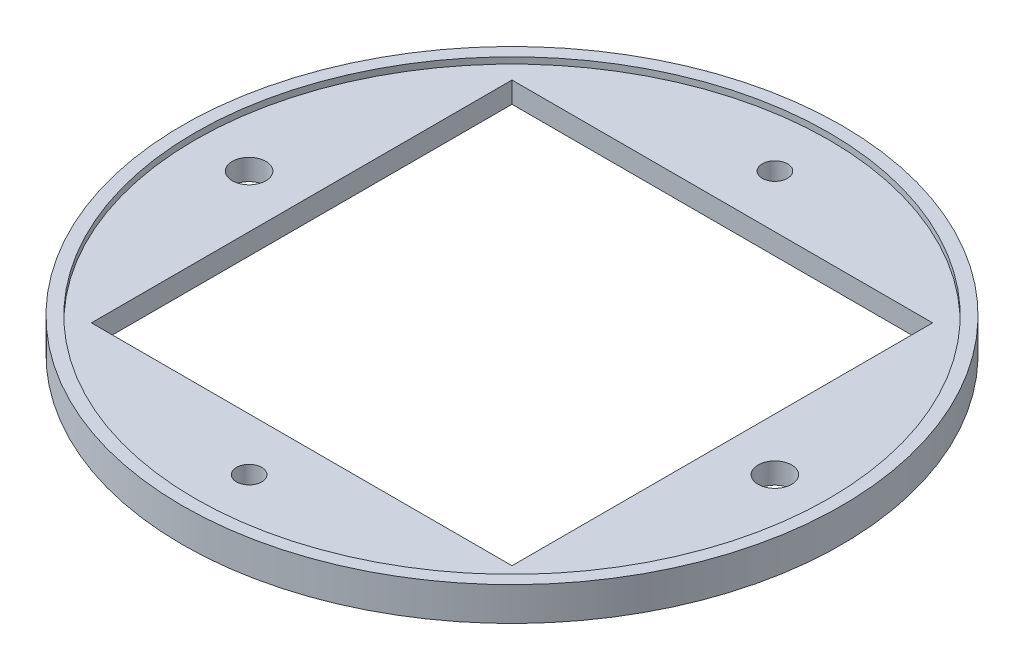
from build123d import *

# Parameters (mm, degrees)
BOSS_EXTRUDE1_DEPTH      = 2.5
BOSS_EXTRUDE1_DEPTH_BACK = 2.5
SKETCH1_R                = 78.35
SKETCH1_R_2              = 4
SKETCH1_R_3              = 3
SKETCH1_W                = 100
SKETCH1_H                = 100
BOSS_EXTRUDE2_DEPTH      = 4
BOSS_EXTRUDE2_DEPTH_BACK = 4
SKETCH2_R                = 78.35
SKETCH2_R_2              = 75.35


with BuildPart() as part:
    # Sketch1 → Boss-Extrude1 (new, two sides: drawn at the far end of the back side and taken through both)
    with BuildSketch(Plane(origin=(0, 0, 0), x_dir=(1, 0, 0), z_dir=(0, 1, 0)).offset(-BOSS_EXTRUDE1_DEPTH_BACK)):
        Circle(SKETCH1_R)
        with Locations((62.5, 0)):
            Circle(SKETCH1_R_2, mode=Mode.SUBTRACT)
        with Locations((-62.5, 0)):
            Circle(SKETCH1_R_2, mode=Mode.SUBTRACT)
        with Locations((0, 62.5)):
            Circle(SKETCH1_R_3, mode=Mode.SUBTRACT)
        with Locations((0, -62.5)):
            Circle(SKETCH1_R_3, mode=Mode.SUBTRACT)
        Rectangle(SKETCH1_W, SKETCH1_H, mode=Mode.SUBTRACT)
    extrude(amount=BOSS_EXTRUDE1_DEPTH + BOSS_EXTRUDE1_DEPTH_BACK)

    # Sketch2 → Boss-Extrude2 (add, two sides: drawn at the far end of the back side and taken through both)
    with BuildSketch(Plane(origin=(0, 0, 0), x_dir=(1, 0, 0), z_dir=(0, 1, 0)).offset(-BOSS_EXTRUDE2_DEPTH_BACK)):
        Circle(SKETCH2_R)
        Circle(SKETCH2_R_2, mode=Mode.SUBTRACT)
    extrude(amount=BOSS_EXTRUDE2_DEPTH + BOSS_EXTRUDE2_DEPTH_BACK)


solid = part.part
